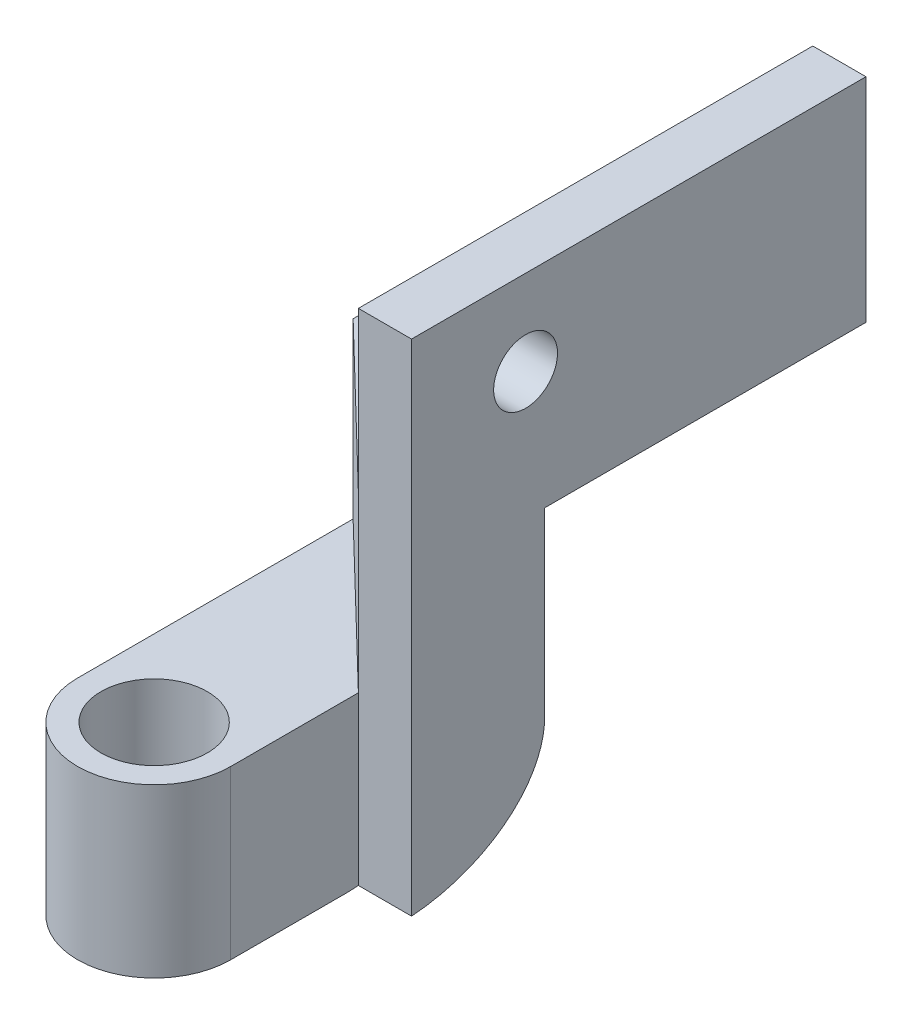
from build123d import *

# Parameters (mm, degrees)
CROQUIS1_R              = 1.5
SALIENTE_EXTRUIR1_DEPTH = 2.5
SALIENTE_EXTRUIR2_START = -8.15
CROQUIS1_4_R            = 2.5
SALIENTE_EXTRUIR2_DEPTH = 7.87
SALIENTE_EXTRUIR3_DEPTH = 16.02
REDONDEO1_R             = 5
CROQUIS3_W              = 21.36
CROQUIS3_H              = 7.5
CROQUIS3_R              = 1.5
SALIENTE_EXTRUIR4_DEPTH = 2.5


with BuildPart() as part:
    # Croquis1 → Saliente-Extruir1 (new body)
    # profile 1 of 2: a face of its own
    with BuildSketch(Plane(origin=(0, 0, 0), x_dir=(1, 0, 0), z_dir=(0, 1, 0))):
        Polygon((3.6, 27.36), (-3.6, 27.36), (-3.6, 19.208695338), (3.6, 12.25573616), align=None)
        with Locations(Location((-0.4, 21.36, 0), (0, 0, 270))):
            Circle(CROQUIS1_R, mode=Mode.SUBTRACT)
    # profile 2 of 2: a face of its own
    with BuildSketch(Plane(origin=(0, 0, 0), x_dir=(1, 0, 0), z_dir=(0, 1, 0))):
        Polygon((3.6, 12.25573616), (-3.6, 19.208695338), (-3.6, 12.952959179), (3.6, 6), align=None)
    extrude(amount=-SALIENTE_EXTRUIR1_DEPTH)



with BuildPart() as body_2:
    # Croquis1<4> → Saliente-Extruir2 (new body)
    with BuildSketch(Plane(origin=(0, 0, 0), x_dir=(1, 0, 0), z_dir=(0, 1, 0)).offset(SALIENTE_EXTRUIR2_START)):
        with BuildLine():
            Line((3.6, 6), (-3.6, 12.952959179))
            Line((-3.6, 12.952959179), (-3.6, 0))
            ThreePointArc((-3.6, 0), (0, -3.6), (3.6, 0))
            Line((3.6, 0), (3.6, 6))
        make_face()
        with Locations(Location((0, 0, 0), (0, 0, 270))):
            Circle(CROQUIS1_4_R, mode=Mode.SUBTRACT)
    extrude(amount=-SALIENTE_EXTRUIR2_DEPTH)


with BuildPart() as part_1:
    add(part.part)

    add(body_2.part)  # Saliente-Extruir3 merges body 2
    # Croquis1<5> → Saliente-Extruir3 (add)
    with BuildSketch(Plane(origin=(0, 0, 0), x_dir=(1, 0, 0), z_dir=(0, 1, 0))):
        Polygon((3.6, 12.25573616), (-3.6, 19.208695338), (-3.6, 12.952959179), (3.6, 6), align=None)
    extrude(amount=-SALIENTE_EXTRUIR3_DEPTH)

    # Redondeo1
    redondeo1_edges = [part_1.edges().sort_by_distance(p)[0] for p in [
        (0, -16.02, -15.732215749),
    ]]
    fillet(redondeo1_edges, radius=REDONDEO1_R)

    # Croquis3 → Saliente-Extruir4 (add)
    # profile 1 of 2: a face of its own
    with BuildSketch(Plane(origin=(3.6, 0, 0), x_dir=(0, 0, -1), z_dir=(1, 0, 0))):
        with BuildLine():
            Line((6, 0), (6, -8.15))
            Line((6, -8.15), (6, -15.994937186))
            add(Edge.make_bspline(
                [(6, -15.994937186), (12.25573616, -15.542670169), (12.25573616, -11.02)],
                knots=[4.821475205, 4.821475205, 4.821475205, 6.283185307, 6.283185307, 6.283185307], degree=2, weights=[0.962144349, 0.727447175, 1]))
            Line((12.25573616, -11.02), (12.25573616, -2.5))
            Line((12.25573616, -2.5), (27.36, -2.5))
            Line((27.36, -2.5), (27.36, 0))
            Line((27.36, 0), (6, 0))
        make_face()
    # profile 2 of 2: a face of its own
    with BuildSketch(Plane(origin=(3.6, 0, 0), x_dir=(0, 0, -1), z_dir=(1, 0, 0))):
        with Locations((16.68, 3.75)):
            Rectangle(CROQUIS3_W, CROQUIS3_H)
        with Locations((11.36, 3.5)):
            Circle(CROQUIS3_R, mode=Mode.SUBTRACT)
    extrude(amount=SALIENTE_EXTRUIR4_DEPTH)


solid = part_1.part
